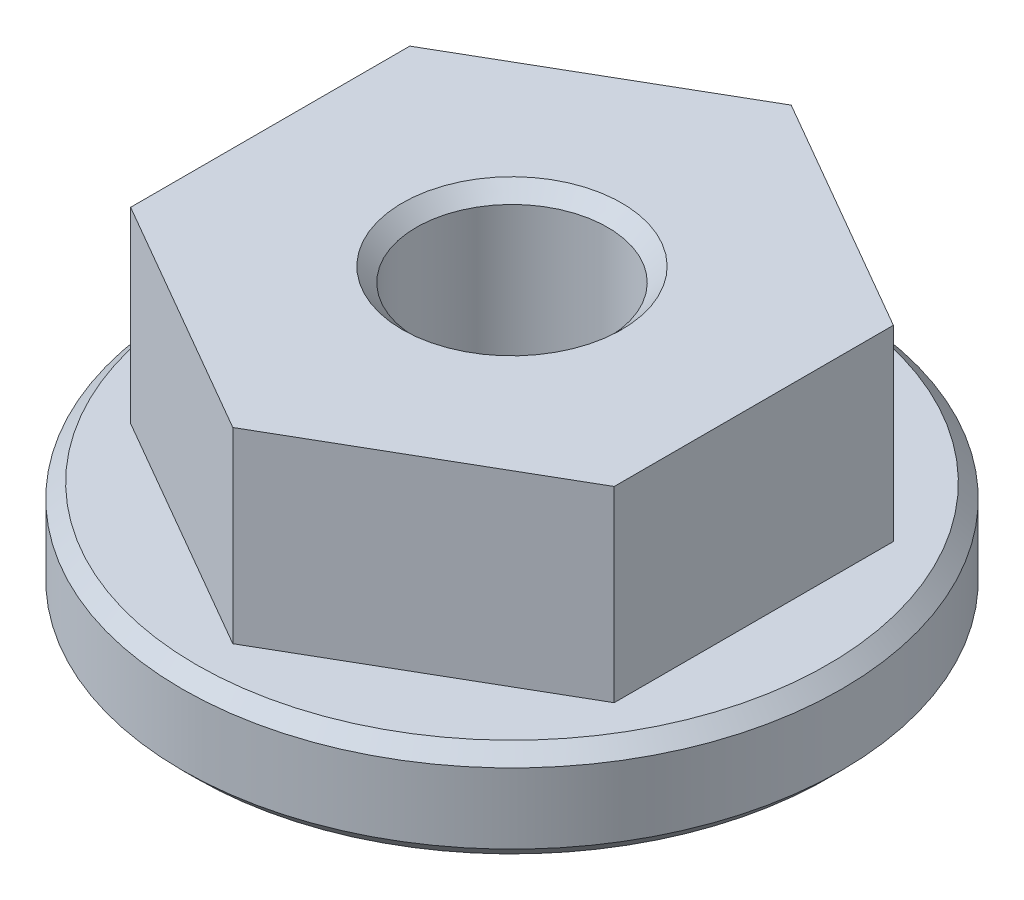
from build123d import *

# Parameters (mm, degrees)
SKETCH1_R             = 5.953125
BOSS_EXTRUDE1_DEPTH   = 1.778
BOSS_EXTRUDE2_DEPTH   = 3.381375
F_8_32_TAPPED_HOLE1_D = 3.4544
CHAMFER1_SIZE         = 0.254


with BuildPart() as part:
    # Sketch1 → Boss-Extrude1 (new body)
    with BuildSketch(Plane(origin=(0, 0, 0), x_dir=(1, 0, 0), z_dir=(0, 1, 0))):
        with Locations(Location((0, 0, 0), (0, 0, 270))):
            Circle(SKETCH1_R)
    extrude(amount=BOSS_EXTRUDE1_DEPTH)

    # Sketch2 → Boss-Extrude2 (add)
    with BuildSketch(Plane(origin=(0, 1.778, 0), x_dir=(1, 0, 0), z_dir=(0, 1, 0))):
        Polygon((4.365625, -2.520494769), (4.365625, 2.520494769), (0, 5.040989538), (-4.365625, 2.520494769), (-4.365625, -2.520494769), (0, -5.040989538), align=None)
    extrude(amount=BOSS_EXTRUDE2_DEPTH)

    # #8-32 Tapped Hole1 (through all)
    with Locations(Plane(origin=(0, 5.159375, 0), x_dir=(1, 0, 0), z_dir=(0, 1, 0))):
        with Locations((0, 0)):
            Hole(F_8_32_TAPPED_HOLE1_D / 2)

    # Chamfer1
    chamfer1_edges = [part.edges().sort_by_distance(p)[0] for p in [
        (0, 0, -5.953125),
        (1.7272, 5.159375, 0),
        (1.7272, 0, 0),
        (0, 1.778, -5.953125),
    ]]
    chamfer(chamfer1_edges, length=CHAMFER1_SIZE)


solid = part.part
